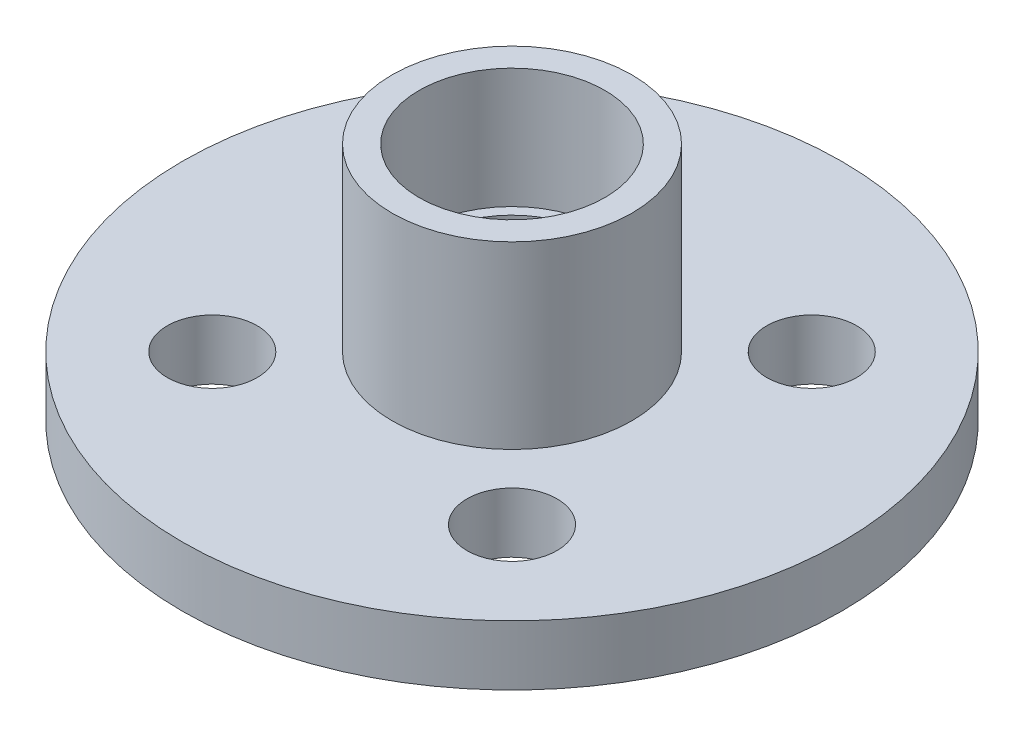
from build123d import *

# Parameters (mm, degrees)
SKETCH_1_R          = 11
SKETCH_1_R_2        = 1.5
EXTRUDE_4_DEPTH     = 2
SKETCH_2_R          = 4
EXTRUDE_5_DEPTH     = 6
SKETCH_3_R          = 3.1
CUT_EXTRUDE_1_DEPTH = 4
SKETCH_4_R          = 2.75
CUT_EXTRUDE_2_DEPTH = 3


with BuildPart() as part:
    # 草图1 → 凸台-拉伸4 (new body)
    with BuildSketch(Plane(origin=(0, 0, 0), x_dir=(1, 0, 0), z_dir=(0, 1, 0))):
        with Locations(Location((0, 0, 0), (0, 0, 270))):
            Circle(SKETCH_1_R)
        with Locations(Location((0, 0, 0), (0, 0, 270))):
            Circle(SKETCH_1_R_2, mode=Mode.SUBTRACT)
        with Locations(Location((-5, 5, 0), (0, 0, 270))):
            Circle(SKETCH_1_R_2, mode=Mode.SUBTRACT)
        with Locations(Location((5, 5, 0), (0, 0, 270))):
            Circle(SKETCH_1_R_2, mode=Mode.SUBTRACT)
        with Locations(Location((5, -5, 0), (0, 0, 270))):
            Circle(SKETCH_1_R_2, mode=Mode.SUBTRACT)
        with Locations(Location((-5, -5, 0), (0, 0, 270))):
            Circle(SKETCH_1_R_2, mode=Mode.SUBTRACT)
    extrude(amount=EXTRUDE_4_DEPTH)

    # 草图2 → 凸台-拉伸5 (add)
    with BuildSketch(Plane(origin=(0, 2, 0), x_dir=(1, 0, 0), z_dir=(0, 1, 0))):
        with Locations(Location((0, 0, 0), (0, 0, 270))):
            Circle(SKETCH_2_R)
    extrude(amount=EXTRUDE_5_DEPTH)

    # 草图3 → 切除-拉伸1 (cut)
    with BuildSketch(Plane(origin=(0, 8, 0), x_dir=(1, 0, 0), z_dir=(0, 1, 0))):
        with Locations(Location((0, 0, 0), (0, 0, 270))):
            Circle(SKETCH_3_R)
    extrude(amount=-CUT_EXTRUDE_1_DEPTH, mode=Mode.SUBTRACT)

    # 草图4 → 切除-拉伸2 (cut)
    with BuildSketch(Plane(origin=(0, 4, 0), x_dir=(1, 0, 0), z_dir=(0, 1, 0))):
        with Locations(Location((0, 0, 0), (0, 0, 270))):
            Circle(SKETCH_4_R)
    extrude(amount=-CUT_EXTRUDE_2_DEPTH, mode=Mode.SUBTRACT)


solid = part.part
